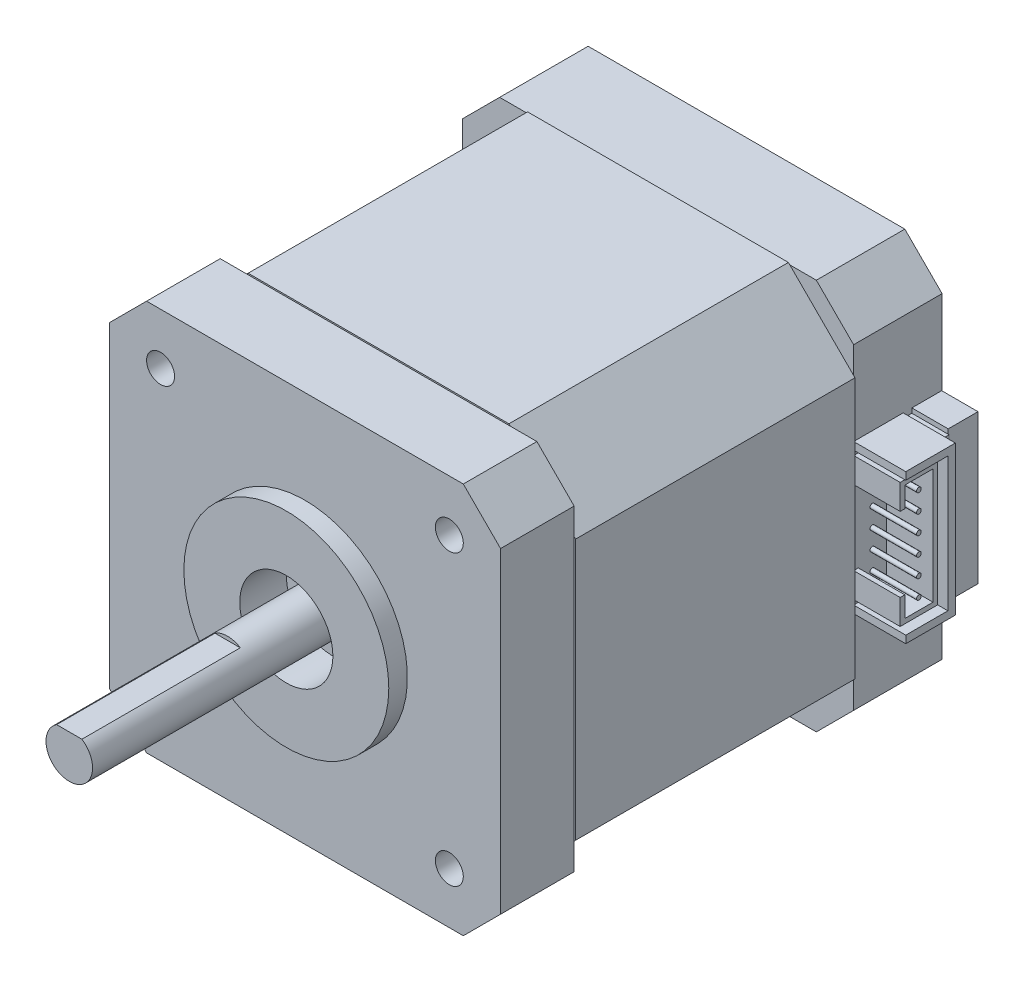
from build123d import *

# Parameters (mm, degrees)
BOSS_EXTRUDE1_DEPTH  = 9.5
BOSS_EXTRUDE2_DEPTH  = 30
BOSS_EXTRUDE3_DEPTH  = 7.9
SKETCH5_R            = 11
SKETCH5_R_2          = 5
BOSS_EXTRUDE4_DEPTH  = 2
CUT_EXTRUDE1_START   = -3
SKETCH6_R            = 5
CUT_EXTRUDE1_DEPTH   = 3
SKETCH7_R            = 2.5
BOSS_EXTRUDE5_DEPTH  = 5
SKETCH8_R            = 2.5
BOSS_EXTRUDE6_DEPTH  = 23.3
CUT_EXTRUDE2_DEPTH   = 17
SKETCH11_W           = 3.2
SKETCH11_H           = 16
BOSS_EXTRUDE8_DEPTH  = 3.9
BOSS_EXTRUDE9_DEPTH  = 5.6
SKETCH13_W           = 0.930512921
SKETCH13_H           = 15
BOSS_EXTRUDE10_DEPTH = 3.9
SKETCH14_W           = 0.930512921
SKETCH14_H           = 15
BOSS_EXTRUDE11_DEPTH = 0.1
BOSS_EXTRUDE12_DEPTH = 5
SKETCH16_R           = 0.25
BOSS_EXTRUDE13_DEPTH = 5
SKETCH17_R           = 1.5
CUT_EXTRUDE3_DEPTH   = 5.5
SKETCH18_R           = 3.25
CUT_EXTRUDE4_DEPTH   = 3
CUT_EXTRUDE5_START   = -4
SKETCH20_R           = 1.5
CUT_EXTRUDE5_DEPTH   = 4
SKETCH21_R           = 4.5
CUT_EXTRUDE6_DEPTH   = 4


with BuildPart() as part:
    # Sketch1 → Boss-Extrude1 (new body)
    with BuildSketch(Plane.XY):
        Polygon((-17, 21), (-21, 17), (-21, -17), (-17, -21), (17, -21), (21, -17), (21, 17), (17, 21), align=None)
    extrude(amount=BOSS_EXTRUDE1_DEPTH)

    # Sketch2 → Boss-Extrude2 (add)
    with BuildSketch(Plane.XY.offset(9.5)):
        Polygon((14, 21.15), (21.15, 14), (21.15, -14), (14, -21.15), (-14, -21.15), (-21.15, -14), (-21.15, 14), (-14, 21.15), align=None)
    extrude(amount=BOSS_EXTRUDE2_DEPTH)

    # Sketch3 → Boss-Extrude3 (add)
    with BuildSketch(Plane.XY.offset(39.5)):
        Polygon((-17, 21), (17, 21), (21, 17), (21, -17), (17, -21), (-17, -21), (-21, -17), (-21, 17), align=None)
    extrude(amount=BOSS_EXTRUDE3_DEPTH)

    # Sketch5 → Boss-Extrude4 (add)
    with BuildSketch(Plane.XY.offset(47.4)):
        with Locations(Location((0, 0, 0), (0, 0, 180))):
            Circle(SKETCH5_R)
        Circle(SKETCH5_R_2, mode=Mode.SUBTRACT)
    extrude(amount=BOSS_EXTRUDE4_DEPTH)

    # Sketch6 → Cut-Extrude1 (cut)
    with BuildSketch(Plane.XY.offset(47.4).offset(CUT_EXTRUDE1_START)):
        Circle(SKETCH6_R)
    extrude(amount=CUT_EXTRUDE1_DEPTH, mode=Mode.SUBTRACT)

    # Sketch7 → Boss-Extrude5 (add)
    with BuildSketch(Plane.XY.offset(44.4)):
        with Locations(Location((0, 0, 0), (0, 0, 180))):
            Circle(SKETCH7_R)
    extrude(amount=BOSS_EXTRUDE5_DEPTH)

    # Sketch8 → Boss-Extrude6 (add)
    with BuildSketch(Plane.XY.offset(49.4)):
        with Locations(Location((0, 0, 0), (0, 0, 180))):
            Circle(SKETCH8_R)
    extrude(amount=BOSS_EXTRUDE6_DEPTH)

    # Sketch9 → Cut-Extrude2 (cut)
    with BuildSketch(Plane.XY.offset(72.7)):
        Polygon((-2.316645086, 2.1), (3.697939095, 2.1), (-0.123554347, 3.991048302), align=None)
    extrude(amount=-CUT_EXTRUDE2_DEPTH, mode=Mode.SUBTRACT)

    # Sketch11 → Boss-Extrude8 (add)
    with BuildSketch(Plane(origin=(21, 0, 0), x_dir=(0, 0, -1), z_dir=(1, 0, 0))):
        with Locations((-1.645589959, 0)):
            Rectangle(SKETCH11_W, SKETCH11_H)
    extrude(amount=BOSS_EXTRUDE8_DEPTH)

    # Sketch12 → Boss-Extrude9 (add)
    with BuildSketch(Plane(origin=(21, 0, 0), x_dir=(0, 0, -1), z_dir=(1, 0, 0))):
        Polygon((-9.5, 7.2), (-4.97610288, 7.2), (-4.97610288, -7.2), (-9.5, -7.2), (-9.5, -8), (-4.17610288, -8), (-4.17610288, -7.2), (-4.17610288, 7.2), (-4.17610288, 8), (-9.5, 8), align=None)
    extrude(amount=BOSS_EXTRUDE9_DEPTH)

    # Sketch13 → Boss-Extrude10 (add)
    with BuildSketch(Plane(origin=(21, 0, 0), x_dir=(0, 0, -1), z_dir=(1, 0, 0))):
        with Locations((-3.71084642, 0)):
            Rectangle(SKETCH13_W, SKETCH13_H)
    extrude(amount=BOSS_EXTRUDE10_DEPTH)

    # Sketch14 → Boss-Extrude11 (add)
    with BuildSketch(Plane(origin=(24.9, 0, 0), x_dir=(0, 0, -1), z_dir=(1, 0, 0))):
        with Locations((-3.71084642, 0)):
            Rectangle(SKETCH14_W, SKETCH14_H)
    extrude(amount=BOSS_EXTRUDE11_DEPTH)

    # Sketch15 → Boss-Extrude12 (add)
    with BuildSketch(Plane(origin=(21, 0, 0), x_dir=(0, 0, -1), z_dir=(1, 0, 0))):
        Polygon((-5.97610288, 6.2), (-9, 6.2), (-9, 4), (-9.5, 4), (-9.5, 6.7), (-9, 6.7), (-5.47610288, 6.7), (-5.47610288, -6.7), (-9, -6.7), (-9.5, -6.7), (-9.5, -4), (-9, -4), (-9, -6.2), (-5.97610288, -6.2), align=None)
    extrude(amount=BOSS_EXTRUDE12_DEPTH)

    # Sketch16 → Boss-Extrude13 (add)
    with BuildSketch(Plane(origin=(21, 0, 0), x_dir=(0, 0, -1), z_dir=(1, 0, 0))):
        with Locations(Location((-7.48805144, 5, 0), (0, 0, 270))):
            Circle(SKETCH16_R)
        with Locations(Location((-7.48805144, 3, 0), (0, 0, 270))):
            Circle(SKETCH16_R)
        with Locations(Location((-7.48805144, 1, 0), (0, 0, 270))):
            Circle(SKETCH16_R)
        with Locations(Location((-7.48805144, -1, 0), (0, 0, 270))):
            Circle(SKETCH16_R)
        with Locations(Location((-7.48805144, -3, 0), (0, 0, 270))):
            Circle(SKETCH16_R)
        with Locations(Location((-7.48805144, -5, 0), (0, 0, 270))):
            Circle(SKETCH16_R)
    extrude(amount=BOSS_EXTRUDE13_DEPTH)

    # Sketch17 → Cut-Extrude3 (cut)
    with BuildSketch(Plane.XY.offset(47.4)):
        with Locations((-15.5, 15.5)):
            Circle(SKETCH17_R)
        with Locations((15.5, 15.5)):
            Circle(SKETCH17_R)
        with Locations((15.5, -15.5)):
            Circle(SKETCH17_R)
        with Locations((-15.5, -15.5)):
            Circle(SKETCH17_R)
    extrude(amount=-CUT_EXTRUDE3_DEPTH, mode=Mode.SUBTRACT)

    # Sketch18 → Cut-Extrude4 (cut)
    with BuildSketch(Plane(origin=(0, 0, 0), x_dir=(-1, 0, 0), z_dir=(0, 0, -1))):
        with Locations((-15.5, 15.5)):
            Circle(SKETCH18_R)
        with Locations((15.5, 15.5)):
            Circle(SKETCH18_R)
        with Locations((15.5, -15.5)):
            Circle(SKETCH18_R)
        with Locations((-15.5, -15.5)):
            Circle(SKETCH18_R)
    extrude(amount=-CUT_EXTRUDE4_DEPTH, mode=Mode.SUBTRACT)

    # Sketch20 → Cut-Extrude5 (cut)
    with BuildSketch(Plane(origin=(0, 0, 3), x_dir=(-1, 0, 0), z_dir=(0, 0, -1)).offset(CUT_EXTRUDE5_START)):
        with Locations(Location((-15.5, 15.5, 0), (0, 0, 180))):
            Circle(SKETCH20_R)
        with Locations(Location((15.5, 15.5, 0), (0, 0, 180))):
            Circle(SKETCH20_R)
        with Locations(Location((-15.5, -15.5, 0), (0, 0, 180))):
            Circle(SKETCH20_R)
        with Locations(Location((15.5, -15.5, 0), (0, 0, 180))):
            Circle(SKETCH20_R)
    extrude(amount=CUT_EXTRUDE5_DEPTH, mode=Mode.SUBTRACT)

    # Sketch21 → Cut-Extrude6 (cut)
    with BuildSketch(Plane(origin=(0, 0, 0), x_dir=(-1, 0, 0), z_dir=(0, 0, -1))):
        Circle(SKETCH21_R)
    extrude(amount=-CUT_EXTRUDE6_DEPTH, mode=Mode.SUBTRACT)


solid = part.part
